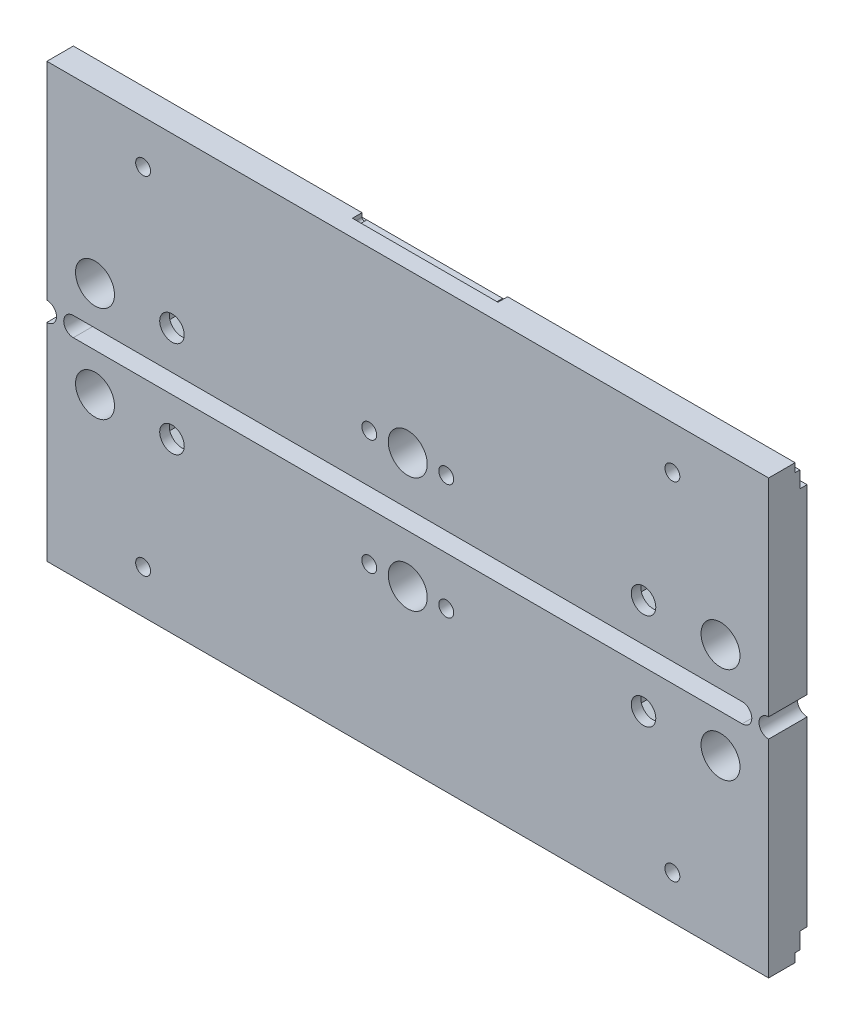
from build123d import *

# Parameters (mm, degrees)
SKETCH_2_W           = 150
SKETCH_2_H           = 43
SKETCH_2_R           = 4.05
EXTRUDE_1_DEPTH      = 8
SKETCH_3_R           = 2.55
CUT_EXTRUDE_1_DEPTH  = 157.246599963
CUT_EXTRUDE_16_DEPTH = 6
CUT_EXTRUDE_2_DEPTH  = 157.246599963
SKETCH_5_R           = 1.55
CUT_EXTRUDE_3_DEPTH  = 157.246599963
CUT_EXTRUDE_5_DEPTH  = 4.5
SKETCH_25_R          = 1.55
CUT_EXTRUDE_13_DEPTH = 157.246599963
CUT_EXTRUDE_11_DEPTH = 2
EXTRUDE_2_DEPTH      = 8


with BuildPart() as part:
    # 草图2 → 凸台-拉伸1 (new body)
    with BuildSketch(Plane.XY):
        with Locations((75, 21.5)):
            Rectangle(SKETCH_2_W, SKETCH_2_H)
        with Locations((10, 8)):
            Circle(SKETCH_2_R, mode=Mode.SUBTRACT)
        with Locations((75, 10)):
            Circle(SKETCH_2_R, mode=Mode.SUBTRACT)
        with Locations((140, 8)):
            Circle(SKETCH_2_R, mode=Mode.SUBTRACT)
    extrude_1 = extrude(amount=EXTRUDE_1_DEPTH)

    # 草图3 → 切除-拉伸1 (cut, through all)
    with BuildSketch(Plane.XY.offset(8)):
        with Locations((26, 8)):
            Circle(SKETCH_3_R)
        with Locations((124, 8)):
            Circle(SKETCH_3_R)
    cut_extrude_1 = extrude(amount=-CUT_EXTRUDE_1_DEPTH, mode=Mode.SUBTRACT)

    # 草图28 → 切除-拉伸16 (cut)
    with BuildSketch(Plane(origin=(0, 0, 0), x_dir=(-1, 0, 0), z_dir=(0, 0, -1))):
        Polygon((-119.9, 5.632863896), (-119.9, 10.367136104), (-124, 12.734272207), (-128.1, 10.367136104), (-128.1, 5.632863896), (-124, 3.265727793), align=None)
        Polygon((-21.9, 5.632863896), (-21.9, 10.367136104), (-26, 12.734272207), (-30.1, 10.367136104), (-30.1, 5.632863896), (-26, 3.265727793), align=None)
    cut_extrude_16 = extrude(amount=-CUT_EXTRUDE_16_DEPTH, mode=Mode.SUBTRACT)

    # 草图4 → 切除-拉伸2 (cut, through all)
    with BuildSketch(Plane(origin=(150, 0, 0), x_dir=(0, 0, -1), z_dir=(1, 0, 0))):
        Polygon((-1.5, 41.2), (-2.5, 41.2), (-2.5, 43), (0, 43), (0, 37.8), (-1.5, 37.8), align=None)
    cut_extrude_2 = extrude(amount=-CUT_EXTRUDE_2_DEPTH, mode=Mode.SUBTRACT)

    # 草图5 → 切除-拉伸3 (cut, through all)
    with BuildSketch(Plane.XY.offset(8)):
        with Locations((83, 10)):
            Circle(SKETCH_5_R)
        with Locations((67, 10)):
            Circle(SKETCH_5_R)
    cut_extrude_3 = extrude(amount=-CUT_EXTRUDE_3_DEPTH, mode=Mode.SUBTRACT)

    # 草图8 → 切除-拉伸5 (cut)
    with BuildSketch(Plane(origin=(0, 0, 0), x_dir=(-1, 0, 0), z_dir=(0, 0, -1))):
        Polygon((-80.15, 8.354551733), (-80.15, 11.645448267), (-83, 13.290896534), (-85.85, 11.645448267), (-85.85, 8.354551733), (-83, 6.709103466), align=None)
        Polygon((-64.15, 8.354551733), (-64.15, 11.645448267), (-67, 13.290896534), (-69.85, 11.645448267), (-69.85, 8.354551733), (-67, 6.709103466), align=None)
    cut_extrude_5 = extrude(amount=-CUT_EXTRUDE_5_DEPTH, mode=Mode.SUBTRACT)

    # 草图25 → 切除-拉伸13 (cut, through all)
    with BuildSketch(Plane(origin=(0, 0, 0), x_dir=(-1, 0, 0), z_dir=(0, 0, -1))):
        with Locations((-130, 34)):
            Circle(SKETCH_25_R)
        with Locations((-20, 34)):
            Circle(SKETCH_25_R)
    cut_extrude_13 = extrude(amount=-CUT_EXTRUDE_13_DEPTH, mode=Mode.SUBTRACT)

    # 草图19 → 切除-拉伸11 (cut)
    with BuildSketch(Plane(origin=(0, 0, 2.5), x_dir=(-1, 0, 0), z_dir=(0, 0, -1))):
        with BuildLine():
            Line((-60, 43), (-90.247938178, 43))
            Line((-90.247938178, 43), (-90.247938178, 42.2))
            ThreePointArc((-90.247938178, 42.2), (-89.747938178, 41.7), (-89.247938178, 42.2))
            Line((-89.247938178, 42.2), (-61, 42.2))
            ThreePointArc((-61, 42.2), (-60.5, 41.7), (-60, 42.2))
            Line((-60, 42.2), (-60, 43))
        make_face()
    cut_extrude_11 = extrude(amount=-CUT_EXTRUDE_11_DEPTH, mode=Mode.SUBTRACT)

    # 草图22 → 凸台-拉伸2 (add)
    with BuildSketch(Plane.XY.offset(8)):
        with BuildLine():
            Line((0, -4), (5.5, -4))
            ThreePointArc((5.5, -4), (3.5, -2), (5.5, 0))
            Line((5.5, 0), (0, 0))
            ThreePointArc((0, 0), (2, -2), (0, -4))
        make_face()
        with BuildLine():
            Line((150, 0), (144.5, 0))
            ThreePointArc((144.5, 0), (146.5, -2), (144.5, -4))
            Line((144.5, -4), (150, -4))
            ThreePointArc((150, -4), (148, -2), (150, 0))
        make_face()
    extrude(amount=-EXTRUDE_2_DEPTH)

    # 镜向2: 凸台-拉伸1, 切除-拉伸1, 切除-拉伸16, 切除-拉伸2, 切除-拉伸3, 切除-拉伸5, 切除-拉伸13, 切除-拉伸11 across plane
    add(extrude_1.mirror(Plane(origin=(0, -2, 0), x_dir=(0, 0, 1), z_dir=(0, -1, 0))))
    add(cut_extrude_1.mirror(Plane(origin=(0, -2, 0), x_dir=(0, 0, 1), z_dir=(0, -1, 0))), mode=Mode.SUBTRACT)
    add(cut_extrude_16.mirror(Plane(origin=(0, -2, 0), x_dir=(0, 0, 1), z_dir=(0, -1, 0))), mode=Mode.SUBTRACT)
    add(cut_extrude_2.mirror(Plane(origin=(0, -2, 0), x_dir=(0, 0, 1), z_dir=(0, -1, 0))), mode=Mode.SUBTRACT)
    add(cut_extrude_3.mirror(Plane(origin=(0, -2, 0), x_dir=(0, 0, 1), z_dir=(0, -1, 0))), mode=Mode.SUBTRACT)
    add(cut_extrude_5.mirror(Plane(origin=(0, -2, 0), x_dir=(0, 0, 1), z_dir=(0, -1, 0))), mode=Mode.SUBTRACT)
    add(cut_extrude_13.mirror(Plane(origin=(0, -2, 0), x_dir=(0, 0, 1), z_dir=(0, -1, 0))), mode=Mode.SUBTRACT)
    add(cut_extrude_11.mirror(Plane(origin=(0, -2, 0), x_dir=(0, 0, 1), z_dir=(0, -1, 0))), mode=Mode.SUBTRACT)


solid = part.part
